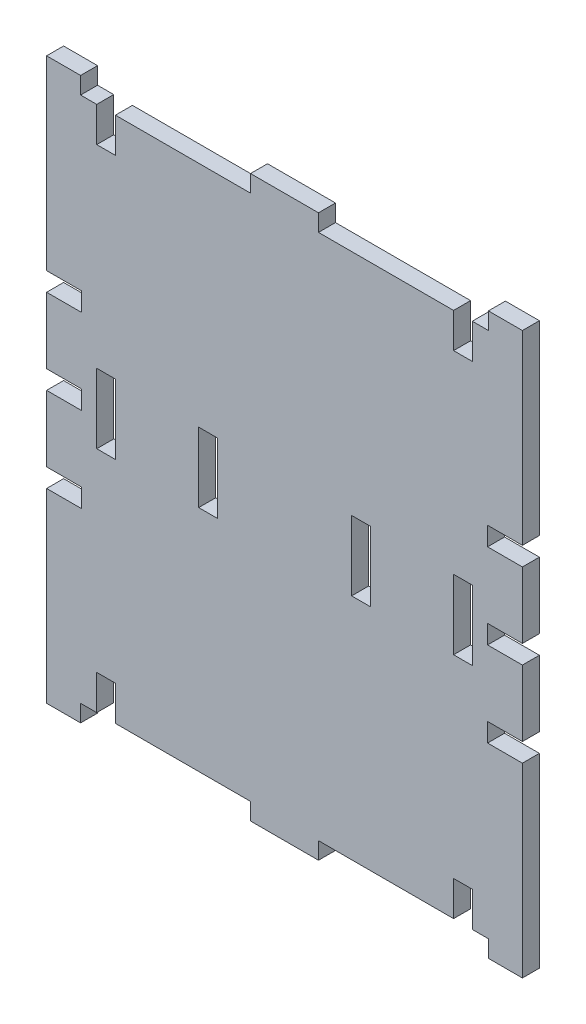
from build123d import *

# Parameters (mm, degrees)
SKETCH1_W           = 5.5
SKETCH1_H           = 20.5
BOSS_EXTRUDE1_DEPTH = 2.5


with BuildPart() as part:
    # Sketch1 → Boss-Extrude1 (new, symmetric)
    with BuildSketch(Plane.XY):
        Polygon((143.545659386, -48.941167375), (143.545659386, -53.941167375), (103.795659386, -53.941167375), (103.795659386, -64.191167375), (98.295659386, -64.191167375), (98.295659386, -53.941167375), (93.545659386, -53.941167375), (93.545659386, -48.941167375), (83.545659386, -48.941167375), (83.545659386, -103.691167375), (93.795659386, -103.691167375), (93.795659386, -109.191167375), (83.545659386, -109.191167375), (83.545659386, -128.691167375), (93.795659386, -128.691167375), (93.795659386, -134.191167375), (83.545659386, -134.191167375), (83.545659386, -153.691167375), (93.795659386, -153.691167375), (93.795659386, -159.191167375), (83.545659386, -159.191167375), (83.545659386, -213.941167375), (93.545659386, -213.941167375), (93.545659386, -208.941167375), (98.295659386, -208.941167375), (98.295659386, -198.691167375), (103.795659386, -198.691167375), (103.795659386, -208.941167375), (143.545659386, -208.941167375), (143.545659386, -213.941167375), (163.545659386, -213.941167375), (163.545659386, -208.941167375), (203.295659386, -208.941167375), (203.295659386, -198.691167375), (208.795659386, -198.691167375), (208.795659386, -208.941167375), (213.545659386, -208.941167375), (213.545659386, -213.941167375), (223.545659386, -213.941167375), (223.545659386, -159.191167375), (213.295659386, -159.191167375), (213.295659386, -153.691167375), (223.545659386, -153.691167375), (223.545659386, -134.191167375), (213.295659386, -134.191167375), (213.295659386, -128.691167375), (223.545659386, -128.691167375), (223.545659386, -109.191167375), (213.295659386, -109.191167375), (213.295659386, -103.691167375), (223.545659386, -103.691167375), (223.545659386, -48.941167375), (213.545659386, -48.941167375), (213.545659386, -53.941167375), (208.795659386, -53.941167375), (208.795659386, -64.191167375), (203.295659386, -64.191167375), (203.295659386, -53.941167375), (163.545659386, -53.941167375), (163.545659386, -48.941167375), align=None)
        with Locations((101.045659386, -131.441167375)):
            Rectangle(SKETCH1_W, SKETCH1_H, mode=Mode.SUBTRACT)
        with Locations((206.045659386, -131.441167375)):
            Rectangle(SKETCH1_W, SKETCH1_H, mode=Mode.SUBTRACT)
        with Locations((176.045659386, -131.441167375)):
            Rectangle(SKETCH1_W, SKETCH1_H, mode=Mode.SUBTRACT)
        with Locations((131.045659386, -131.441167375)):
            Rectangle(SKETCH1_W, SKETCH1_H, mode=Mode.SUBTRACT)
    extrude(amount=BOSS_EXTRUDE1_DEPTH, both=True)


solid = part.part
